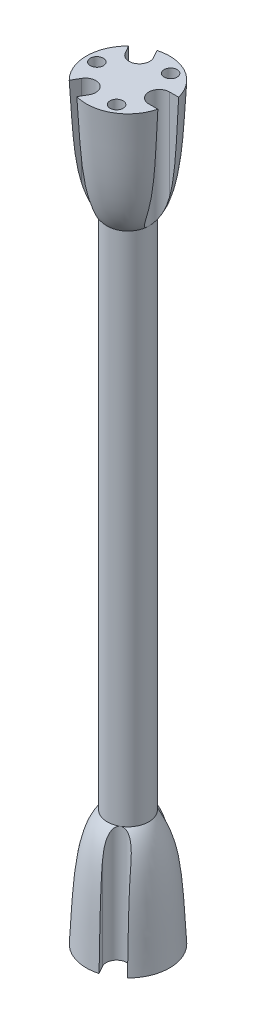
from build123d import *

# Parameters (mm, degrees)
SKETCH2_R                      = 6.35
BOSS_EXTRUDE1_DEPTH            = 228.6
SKETCH3_R                      = 2.000000064
CUT_EXTRUDE1_DEPTH             = 6.99999997
CUT_EXTRUDE3_REACH             = 231.304
SKETCH5_R                      = 2.000000064
CUT_EXTRUDE4_DEPTH             = 6.99999997
CUT_EXTRUDE5_REACH             = 231.304
CUT_EXTRUDE5_DIRECTION_2_DEPTH = 230.304470194


with BuildPart() as part:
    # Sketch1 → Revolve1 (revolve)
    with BuildSketch(Plane.XY):
        with BuildLine():
            Line((0, 0), (0, 38.1))
            add(Edge.make_bspline(
                [(0, 38.1), (12.076229003, 38.402893701), (11.580806598, 18.101185873), (12.7, 0)],
                knots=[0, 0, 0, 0, 1, 1, 1, 1], degree=3))
            Line((12.7, 0), (0, 0))
        make_face()
        with BuildLine():
            Line((0, 228.6), (12.7, 228.6))
            add(Edge.make_bspline(
                [(0, 190.5), (12.076229003, 190.197106299), (11.580806598, 210.498814127), (12.7, 228.6)],
                knots=[0, 0, 0, 0, 1, 1, 1, 1], degree=3))
            Line((0, 190.5), (0, 228.6))
        make_face()
    revolve(axis=Axis((0, 0, 0), (0, 1, 0)))

    # Sketch2 → Boss-Extrude1 (add)
    with BuildSketch(Plane.XZ):
        with Locations(Location((0, 0, 0), (0, 0, 270))):
            Circle(SKETCH2_R)
    extrude(amount=-BOSS_EXTRUDE1_DEPTH)

    # Sketch3 → Cut-Extrude1 (cut)
    with BuildSketch(Plane(origin=(0, 0, 0), x_dir=(-1, 0, 0), z_dir=(0, -1, 0))):
        with Locations(Location((-9.525, 0, 0), (0, 0, 90))):
            Circle(SKETCH3_R)
        with Locations(Location((4.7625, 8.248891971, 0), (0, 0, 90))):
            Circle(SKETCH3_R)
        with Locations(Location((4.7625, -8.248891971, 0), (0, 0, 90))):
            Circle(SKETCH3_R)
    extrude(amount=-CUT_EXTRUDE1_DEPTH, mode=Mode.SUBTRACT)

    # Sketch4 → Cut-Extrude3 (cut, up to next)
    with BuildSketch(Plane.XZ, mode=Mode.PRIVATE) as cut_extrude3_sk1:
        with BuildLine():
            Line((-15.875, 3.175), (-9.525, 3.175))
            ThreePointArc((-9.525, 3.175), (-6.35, 0), (-9.525, -3.175))
            Line((-9.525, -3.175), (-15.875, -3.175))
            ThreePointArc((-15.875, -3.175), (-19.05, 0), (-15.875, 3.175))
        make_face()
    cut_extrude3_tool1 = extrude(cut_extrude3_sk1.sketch, amount=-CUT_EXTRUDE3_REACH, mode=Mode.PRIVATE) & part.part
    # Sketch4 → Cut-Extrude3 (cut, up to next)
    with BuildSketch(Plane.XZ, mode=Mode.PRIVATE) as cut_extrude3_sk2:
        with BuildLine():
            Line((10.687130657, 12.160653285), (7.512130657, 6.661391971))
            ThreePointArc((7.512130657, 6.661391971), (3.175, 5.499261314), (2.012869343, 9.836391971))
            Line((2.012869343, 9.836391971), (5.187869343, 15.335653285))
            ThreePointArc((5.187869343, 15.335653285), (9.525, 16.497783942), (10.687130657, 12.160653285))
        make_face()
    cut_extrude3_tool2 = extrude(cut_extrude3_sk2.sketch, amount=-CUT_EXTRUDE3_REACH, mode=Mode.PRIVATE) & part.part
    # Sketch4 → Cut-Extrude3 (cut, up to next)
    with BuildSketch(Plane.XZ, mode=Mode.PRIVATE) as cut_extrude3_sk3:
        with BuildLine():
            Line((5.187869343, -15.335653285), (2.012869343, -9.836391971))
            ThreePointArc((2.012869343, -9.836391971), (3.175, -5.499261314), (7.512130657, -6.661391971))
            Line((7.512130657, -6.661391971), (10.687130657, -12.160653285))
            ThreePointArc((10.687130657, -12.160653285), (9.525, -16.497783942), (5.187869343, -15.335653285))
        make_face()
    cut_extrude3_tool3 = extrude(cut_extrude3_sk3.sketch, amount=-CUT_EXTRUDE3_REACH, mode=Mode.PRIVATE) & part.part
    add(cut_extrude3_tool1.solids().sort_by_distance((-12.7, 0, 0))[0], mode=Mode.SUBTRACT)
    add(cut_extrude3_tool2.solids().sort_by_distance((6.35, 0, 10.998523))[0], mode=Mode.SUBTRACT)
    add(cut_extrude3_tool3.solids().sort_by_distance((6.35, 0, -10.998523))[0], mode=Mode.SUBTRACT)

    # Sketch5 → Cut-Extrude4 (cut)
    with BuildSketch(Plane(origin=(0, 228.6, 0), x_dir=(1, 0, 0), z_dir=(0, 1, 0))):
        with Locations(Location((-9.525, 0, 0), (0, 0, 270))):
            Circle(SKETCH5_R)
        with Locations(Location((4.7625, 8.248891971, 0), (0, 0, 270))):
            Circle(SKETCH5_R)
        with Locations(Location((4.7625, -8.248891971, 0), (0, 0, 270))):
            Circle(SKETCH5_R)
    extrude(amount=-CUT_EXTRUDE4_DEPTH, mode=Mode.SUBTRACT)

    # Sketch6 → Cut-Extrude5 (cut, up to next)
    with BuildSketch(Plane(origin=(0, 228.6, 0), x_dir=(1, 0, 0), z_dir=(0, 1, 0)), mode=Mode.PRIVATE) as cut_extrude5_sk1:
        with BuildLine():
            Line((15.875, -3.175), (9.525, -3.175))
            ThreePointArc((9.525, -3.175), (6.35, 0), (9.525, 3.175))
            Line((9.525, 3.175), (15.875, 3.175))
            ThreePointArc((15.875, 3.175), (19.05, 0), (15.875, -3.175))
        make_face()
    cut_extrude5_tool1 = extrude(cut_extrude5_sk1.sketch, amount=-CUT_EXTRUDE5_REACH, mode=Mode.PRIVATE) & part.part
    # Sketch6 → Cut-Extrude5 (cut, up to next)
    with BuildSketch(Plane(origin=(0, 228.6, 0), x_dir=(1, 0, 0), z_dir=(0, 1, 0)), mode=Mode.PRIVATE) as cut_extrude5_sk2:
        with BuildLine():
            Line((-10.687130657, -12.160653285), (-7.512130657, -6.661391971))
            ThreePointArc((-7.512130657, -6.661391971), (-3.175, -5.499261314), (-2.012869343, -9.836391971))
            Line((-2.012869343, -9.836391971), (-5.187869343, -15.335653285))
            ThreePointArc((-5.187869343, -15.335653285), (-9.525, -16.497783942), (-10.687130657, -12.160653285))
        make_face()
    cut_extrude5_tool2 = extrude(cut_extrude5_sk2.sketch, amount=-CUT_EXTRUDE5_REACH, mode=Mode.PRIVATE) & part.part
    # Sketch6 → Cut-Extrude5 (cut, up to next)
    with BuildSketch(Plane(origin=(0, 228.6, 0), x_dir=(1, 0, 0), z_dir=(0, 1, 0)), mode=Mode.PRIVATE) as cut_extrude5_sk3:
        with BuildLine():
            Line((-5.187869343, 15.335653285), (-2.012869343, 9.836391971))
            ThreePointArc((-2.012869343, 9.836391971), (-3.175, 5.499261314), (-7.512130657, 6.661391971))
            Line((-7.512130657, 6.661391971), (-10.687130657, 12.160653285))
            ThreePointArc((-10.687130657, 12.160653285), (-9.525, 16.497783942), (-5.187869343, 15.335653285))
        make_face()
    cut_extrude5_tool3 = extrude(cut_extrude5_sk3.sketch, amount=-CUT_EXTRUDE5_REACH, mode=Mode.PRIVATE) & part.part
    add(cut_extrude5_tool1.solids().sort_by_distance((12.7, 228.6, 0))[0], mode=Mode.SUBTRACT)
    add(cut_extrude5_tool2.solids().sort_by_distance((-6.35, 228.6, 10.998523))[0], mode=Mode.SUBTRACT)
    add(cut_extrude5_tool3.solids().sort_by_distance((-6.35, 228.6, -10.998523))[0], mode=Mode.SUBTRACT)

    # Sketch6 → Cut-Extrude5 direction 2 (cut)
    with BuildSketch(Plane(origin=(0, 228.6, 0), x_dir=(1, 0, 0), z_dir=(0, 1, 0))):
        with BuildLine():
            Line((15.875, -3.175), (9.525, -3.175))
            ThreePointArc((9.525, -3.175), (6.35, 0), (9.525, 3.175))
            Line((9.525, 3.175), (15.875, 3.175))
            ThreePointArc((15.875, 3.175), (19.05, 0), (15.875, -3.175))
        make_face()
        with BuildLine():
            Line((-10.687130657, -12.160653285), (-7.512130657, -6.661391971))
            ThreePointArc((-7.512130657, -6.661391971), (-3.175, -5.499261314), (-2.012869343, -9.836391971))
            Line((-2.012869343, -9.836391971), (-5.187869343, -15.335653285))
            ThreePointArc((-5.187869343, -15.335653285), (-9.525, -16.497783942), (-10.687130657, -12.160653285))
        make_face()
        with BuildLine():
            Line((-5.187869343, 15.335653285), (-2.012869343, 9.836391971))
            ThreePointArc((-2.012869343, 9.836391971), (-3.175, 5.499261314), (-7.512130657, 6.661391971))
            Line((-7.512130657, 6.661391971), (-10.687130657, 12.160653285))
            ThreePointArc((-10.687130657, 12.160653285), (-9.525, 16.497783942), (-5.187869343, 15.335653285))
        make_face()
    extrude(amount=CUT_EXTRUDE5_DIRECTION_2_DEPTH, mode=Mode.SUBTRACT)


solid = part.part
